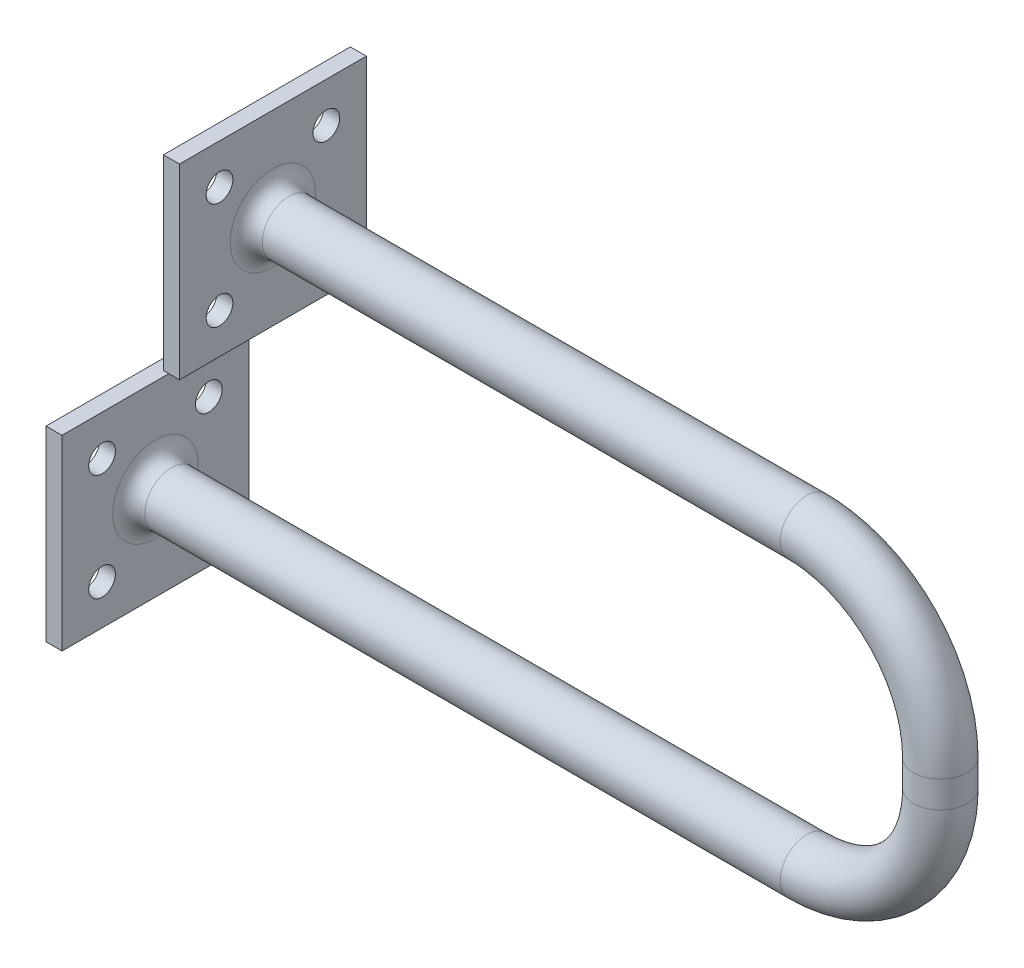
from build123d import *

# Parameters (mm, degrees)
SKETCH1_W            = 35
SKETCH1_H            = 35
BOSS_EXTRUDE1_DEPTH  = 3
SKETCH2_R            = 2.5
CUT_EXTRUDE1_DEPTH   = 25.929901725
LPATTERN1_COUNT      = 2
LPATTERN1_PITCH      = 20
LPATTERN1_COUNT_DIR2 = 2
LPATTERN1_PITCH_DIR2 = 20
SKETCH9_R            = 5
SKETCH10_W           = 35
SKETCH10_H           = 35
BOSS_EXTRUDE2_DEPTH  = 3
SKETCH11_R           = 2.5
CUT_EXTRUDE2_DEPTH   = 153.484424314
LPATTERN4_COUNT      = 2
LPATTERN4_PITCH      = 20
LPATTERN4_COUNT_DIR2 = 2
LPATTERN4_PITCH_DIR2 = 20
FILLET1_R            = 3
FILLET2_R            = 3


with BuildPart() as part:
    # Sketch1 → Boss-Extrude1 (new body)
    with BuildSketch(Plane(origin=(0, 0, 0), x_dir=(0, 0, -1), z_dir=(1, 0, 0))):
        Rectangle(SKETCH1_W, SKETCH1_H)
    extrude(amount=BOSS_EXTRUDE1_DEPTH)

    # Sketch2 → Cut-Extrude1 (cut, through all)
    with BuildSketch(Plane(origin=(3, 0, 0), x_dir=(0, 0, -1), z_dir=(1, 0, 0))):
        with Locations((10, 10)):
            Circle(SKETCH2_R)
    cut_extrude1 = extrude(amount=-CUT_EXTRUDE1_DEPTH, mode=Mode.SUBTRACT)

    # LPattern1: Cut-Extrude1 2 × 2
    with Locations(*[(0, -j * LPATTERN1_PITCH_DIR2, i * LPATTERN1_PITCH) for i in range(LPATTERN1_COUNT) for j in range(LPATTERN1_COUNT_DIR2) if (i, j) != (0, 0)]):
        add(cut_extrude1, mode=Mode.SUBTRACT)

    # Sweep1: sweep along a path in Sketch8
    with BuildLine(Plane.XY) as sweep1_path:
        Line((3, 0), (125, 0))
        ThreePointArc((125, 0), (142.677670206, 7.32233044), (150.000001, 25.0000005))
        Line((150.000001, 25.0000005), (150.000001, 30.0000005))
        ThreePointArc((150.000001, 30.0000005), (142.677670383, 47.677670383), (125.0000005, 55.000001))
        Line((125.0000005, 55.000001), (25.0000005, 55.000001))
    # Sketch9 → Sweep1 (sweep)
    with BuildSketch(Plane(origin=(3, 0, 0), x_dir=(0, 0, -1), z_dir=(1, 0, 0))):
        Circle(SKETCH9_R)
    sweep(path=sweep1_path.line)

    # Sketch10 → Boss-Extrude2 (add)
    with BuildSketch(Plane(origin=(25.000001599, 5e-07, 0), x_dir=(0, 0, 1), z_dir=(-0.9999999999999998, -1.9990267318907433e-08, 0))):
        with Locations((0, 54.999998501)):
            Rectangle(SKETCH10_W, SKETCH10_H)
    extrude(amount=BOSS_EXTRUDE2_DEPTH)

    # Sketch11 → Cut-Extrude2 (cut, through all)
    with BuildSketch(Plane(origin=(22.000001599, 4.4e-07, 0), x_dir=(0, 0, 1), z_dir=(-0.9999999999999998, -1.999026737793079e-08, 0))):
        with Locations(Location((9.999489763, 64.999488264, 0), (0, 0, 270))):
            Circle(SKETCH11_R)
    cut_extrude2 = extrude(amount=-CUT_EXTRUDE2_DEPTH, mode=Mode.SUBTRACT)

    # LPattern4: Cut-Extrude2 2 × 2
    with Locations(*[(0, -j * LPATTERN4_PITCH_DIR2, -i * LPATTERN4_PITCH) for i in range(LPATTERN4_COUNT) for j in range(LPATTERN4_COUNT_DIR2) if (i, j) != (0, 0)]):
        add(cut_extrude2, mode=Mode.SUBTRACT)

    # Fillet1
    fillet1_edges = [part.edges().sort_by_distance(p)[0] for p in [
        (25.0000005, 55.000001, 5),
    ]]
    fillet(fillet1_edges, radius=FILLET1_R)

    # Fillet2
    fillet2_edges = [part.edges().sort_by_distance(p)[0] for p in [
        (3, 0, 5),
    ]]
    fillet(fillet2_edges, radius=FILLET2_R)


solid = part.part
